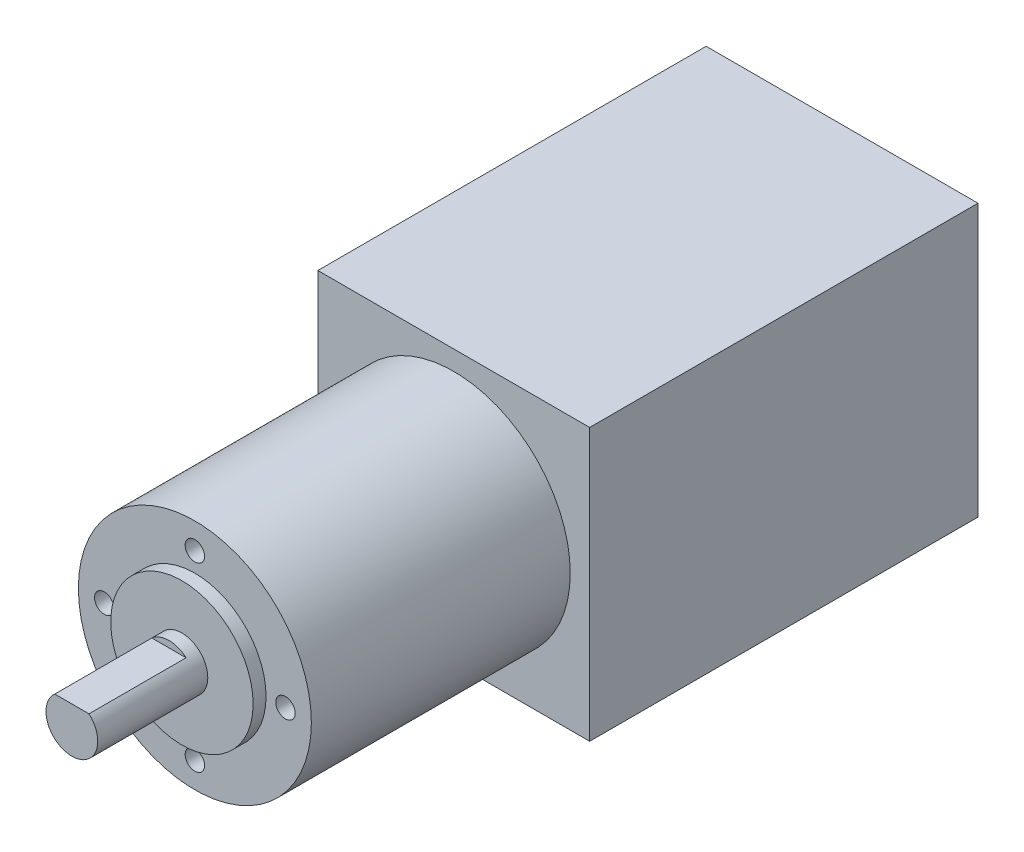
from build123d import *

# Parameters (mm, degrees)
SKETCH_1_W          = 42
SKETCH_1_H          = 42
EXTRUDE_1_DEPTH     = 60
SKETCH_2_R          = 18
EXTRUDE_2_DEPTH     = 40
SKETCH_3_R          = 11
EXTRUDE_3_DEPTH     = 2
SKETCH_4_R          = 4
EXTRUDE_4_DEPTH     = 17
SKETCH_5_R          = 1.5
CUT_EXTRUDE_1_DEPTH = 4
CUT_EXTRUDE_START   = -15
CUT_EXTRUDE_2_DEPTH = 15


with BuildPart() as part:
    # 草图1 → 凸台-拉伸1 (new body)
    with BuildSketch(Plane.XY):
        Rectangle(SKETCH_1_W, SKETCH_1_H)
    extrude(amount=EXTRUDE_1_DEPTH)

    # 草图2 → 凸台-拉伸2 (add)
    with BuildSketch(Plane.XY.offset(60)):
        Circle(SKETCH_2_R)
    extrude(amount=EXTRUDE_2_DEPTH)

    # 草图3 → 凸台-拉伸3 (add)
    with BuildSketch(Plane.XY.offset(100)):
        Circle(SKETCH_3_R)
    extrude(amount=EXTRUDE_3_DEPTH)

    # 草图4 → 凸台-拉伸4 (add)
    with BuildSketch(Plane.XY.offset(102)):
        Circle(SKETCH_4_R)
    extrude(amount=EXTRUDE_4_DEPTH)

    # 草图5 → 切除-拉伸1 (cut)
    with BuildSketch(Plane.XY.offset(100)):
        with Locations((0, 14)):
            Circle(SKETCH_5_R)
        with Locations((14, 0)):
            Circle(SKETCH_5_R)
        with Locations((0, -14)):
            Circle(SKETCH_5_R)
        with Locations((-14, 0)):
            Circle(SKETCH_5_R)
    extrude(amount=-CUT_EXTRUDE_1_DEPTH, mode=Mode.SUBTRACT)

    # 草图6 → 切除-拉伸2 (cut)
    with BuildSketch(Plane.XY.offset(119).offset(CUT_EXTRUDE_START)):
        with BuildLine():
            Line((2.645751311, 3), (-2.645751311, 3))
            ThreePointArc((-2.645751311, 3), (0, 4), (2.645751311, 3))
        make_face()
    extrude(amount=CUT_EXTRUDE_2_DEPTH, mode=Mode.SUBTRACT)


solid = part.part
